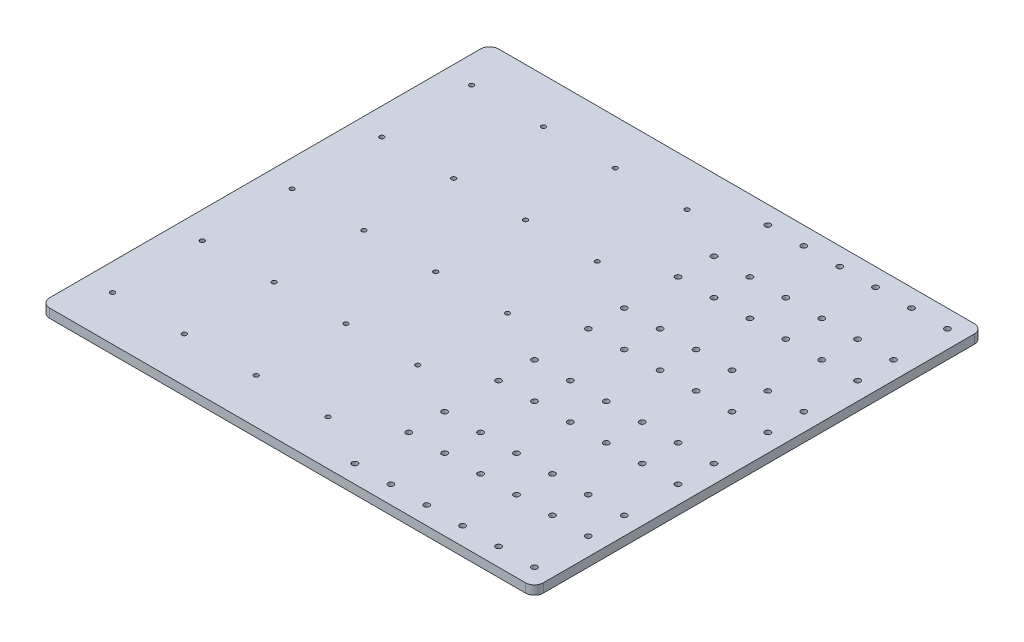
from build123d import *

# Parameters (mm, degrees)
SKETCH2_W                  = 275
SKETCH2_H                  = 50
BOSS_EXTRUDE1_DEPTH        = 5
SKETCH3_R                  = 1.25
CUT_EXTRUDE1_DEPTH         = 140.843662709
SKETCH5_R                  = 1.55
CUT_EXTRUDE3_DEPTH         = 140.843662709
LPATTERN1_COUNT            = 6
LPATTERN1_PITCH            = 20
LPATTERN3_COUNT            = 5
LPATTERN3_PITCH            = 50
LPATTERN3_COPY_1_SKETCH_R  = 1.55
LPATTERN3_COPY_1_DEPTH     = 140.843662709
LPATTERN3_COPY_2_SKETCH_R  = 1.55
LPATTERN3_COPY_2_DEPTH     = 140.843662709
LPATTERN3_COPY_3_SKETCH_R  = 1.55
LPATTERN3_COPY_3_DEPTH     = 140.843662709
LPATTERN3_COPY_4_SKETCH_R  = 1.55
LPATTERN3_COPY_4_DEPTH     = 140.843662709
LPATTERN3_COPY_5_SKETCH_R  = 1.55
LPATTERN3_COPY_5_DEPTH     = 140.843662709
LPATTERN3_COPY_6_SKETCH_R  = 1.55
LPATTERN3_COPY_6_DEPTH     = 140.843662709
LPATTERN3_COPY_7_SKETCH_R  = 1.55
LPATTERN3_COPY_7_DEPTH     = 140.843662709
LPATTERN3_COPY_8_SKETCH_R  = 1.55
LPATTERN3_COPY_8_DEPTH     = 140.843662709
LPATTERN3_COPY_9_SKETCH_R  = 1.55
LPATTERN3_COPY_9_DEPTH     = 140.843662709
LPATTERN3_COPY_10_SKETCH_R = 1.55
LPATTERN3_COPY_10_DEPTH    = 140.843662709
LPATTERN3_COPY_11_SKETCH_R = 1.55
LPATTERN3_COPY_11_DEPTH    = 140.843662709
LPATTERN3_COPY_12_SKETCH_R = 1.55
LPATTERN3_COPY_12_DEPTH    = 140.843662709
LPATTERN3_COPY_13_SKETCH_R = 1.55
LPATTERN3_COPY_13_DEPTH    = 140.843662709
LPATTERN3_COPY_14_SKETCH_R = 1.55
LPATTERN3_COPY_14_DEPTH    = 140.843662709
LPATTERN3_COPY_15_SKETCH_R = 1.55
LPATTERN3_COPY_15_DEPTH    = 140.843662709
LPATTERN3_COPY_16_SKETCH_R = 1.55
LPATTERN3_COPY_16_DEPTH    = 140.843662709
LPATTERN3_COPY_17_SKETCH_R = 1.55
LPATTERN3_COPY_17_DEPTH    = 140.843662709
LPATTERN3_COPY_18_SKETCH_R = 1.55
LPATTERN3_COPY_18_DEPTH    = 140.843662709
LPATTERN3_COPY_19_SKETCH_R = 1.55
LPATTERN3_COPY_19_DEPTH    = 140.843662709
LPATTERN3_COPY_20_SKETCH_R = 1.55
LPATTERN3_COPY_20_DEPTH    = 140.843662709
FILLET1_R                  = 5


with BuildPart() as part:
    # Sketch2 → Boss-Extrude1 (new body)
    with BuildSketch(Plane(origin=(0, 0, 0), x_dir=(1, 0, 0), z_dir=(0, 1, 0))):
        Rectangle(SKETCH2_W, SKETCH2_H)
    boss_extrude1 = extrude(amount=BOSS_EXTRUDE1_DEPTH)

    # Sketch3 → Cut-Extrude1 (cut, through all)
    with BuildSketch(Plane.XZ):
        with Locations(Location((-122.5, 0, 0), (0, 0, 270))):
            Circle(SKETCH3_R)
        with Locations(Location((-82.5, 0, 0), (0, 0, 270))):
            Circle(SKETCH3_R)
        with Locations(Location((-42.5, 0, 0), (0, 0, 270))):
            Circle(SKETCH3_R)
        with Locations(Location((-2.5, 0, 0), (0, 0, 270))):
            Circle(SKETCH3_R)
    cut_extrude1 = extrude(amount=-CUT_EXTRUDE1_DEPTH, mode=Mode.SUBTRACT)

    # Sketch5 → Cut-Extrude3 (cut, through all)
    with BuildSketch(Plane.XZ):
        with Locations(Location((127.5, 15, 0), (0, 0, 270))):
            Circle(SKETCH5_R)
        with Locations(Location((127.5, -15, 0), (0, 0, 270))):
            Circle(SKETCH5_R)
    cut_extrude3 = extrude(amount=-CUT_EXTRUDE3_DEPTH, mode=Mode.SUBTRACT)

    # LPattern1: Cut-Extrude3 ×6
    with Locations(*[(-i * LPATTERN1_PITCH, 0, 0) for i in range(1, LPATTERN1_COUNT)]):
        add(cut_extrude3, mode=Mode.SUBTRACT)

    # LPattern3: Boss-Extrude1, Cut-Extrude1, Cut-Extrude3 ×5
    with Locations(*[(0, 0, -i * LPATTERN3_PITCH) for i in range(1, LPATTERN3_COUNT)]):
        add(boss_extrude1)
        add(cut_extrude1, mode=Mode.SUBTRACT)
        add(cut_extrude3, mode=Mode.SUBTRACT)

    # LPattern3 copy 1 sketch → LPattern3 copy 1 (cut, through all)
    with BuildSketch(Plane(origin=(-20, 0, -50), x_dir=(1, 0, 0), z_dir=(0, -1, 0))):
        with Locations(Location((127.5, 15, 0), (0, 0, 270))):
            Circle(LPATTERN3_COPY_1_SKETCH_R)
        with Locations(Location((127.5, -15, 0), (0, 0, 270))):
            Circle(LPATTERN3_COPY_1_SKETCH_R)
    extrude(amount=-LPATTERN3_COPY_1_DEPTH, mode=Mode.SUBTRACT)

    # LPattern3 copy 2 sketch → LPattern3 copy 2 (cut, through all)
    with BuildSketch(Plane(origin=(-20, 0, -100), x_dir=(1, 0, 0), z_dir=(0, -1, 0))):
        with Locations(Location((127.5, 15, 0), (0, 0, 270))):
            Circle(LPATTERN3_COPY_2_SKETCH_R)
        with Locations(Location((127.5, -15, 0), (0, 0, 270))):
            Circle(LPATTERN3_COPY_2_SKETCH_R)
    extrude(amount=-LPATTERN3_COPY_2_DEPTH, mode=Mode.SUBTRACT)

    # LPattern3 copy 3 sketch → LPattern3 copy 3 (cut, through all)
    with BuildSketch(Plane(origin=(-20, 0, -150), x_dir=(1, 0, 0), z_dir=(0, -1, 0))):
        with Locations(Location((127.5, 15, 0), (0, 0, 270))):
            Circle(LPATTERN3_COPY_3_SKETCH_R)
        with Locations(Location((127.5, -15, 0), (0, 0, 270))):
            Circle(LPATTERN3_COPY_3_SKETCH_R)
    extrude(amount=-LPATTERN3_COPY_3_DEPTH, mode=Mode.SUBTRACT)

    # LPattern3 copy 4 sketch → LPattern3 copy 4 (cut, through all)
    with BuildSketch(Plane(origin=(-20, 0, -200), x_dir=(1, 0, 0), z_dir=(0, -1, 0))):
        with Locations(Location((127.5, 15, 0), (0, 0, 270))):
            Circle(LPATTERN3_COPY_4_SKETCH_R)
        with Locations(Location((127.5, -15, 0), (0, 0, 270))):
            Circle(LPATTERN3_COPY_4_SKETCH_R)
    extrude(amount=-LPATTERN3_COPY_4_DEPTH, mode=Mode.SUBTRACT)

    # LPattern3 copy 5 sketch → LPattern3 copy 5 (cut, through all)
    with BuildSketch(Plane(origin=(-40, 0, -50), x_dir=(1, 0, 0), z_dir=(0, -1, 0))):
        with Locations(Location((127.5, 15, 0), (0, 0, 270))):
            Circle(LPATTERN3_COPY_5_SKETCH_R)
        with Locations(Location((127.5, -15, 0), (0, 0, 270))):
            Circle(LPATTERN3_COPY_5_SKETCH_R)
    extrude(amount=-LPATTERN3_COPY_5_DEPTH, mode=Mode.SUBTRACT)

    # LPattern3 copy 6 sketch → LPattern3 copy 6 (cut, through all)
    with BuildSketch(Plane(origin=(-40, 0, -100), x_dir=(1, 0, 0), z_dir=(0, -1, 0))):
        with Locations(Location((127.5, 15, 0), (0, 0, 270))):
            Circle(LPATTERN3_COPY_6_SKETCH_R)
        with Locations(Location((127.5, -15, 0), (0, 0, 270))):
            Circle(LPATTERN3_COPY_6_SKETCH_R)
    extrude(amount=-LPATTERN3_COPY_6_DEPTH, mode=Mode.SUBTRACT)

    # LPattern3 copy 7 sketch → LPattern3 copy 7 (cut, through all)
    with BuildSketch(Plane(origin=(-40, 0, -150), x_dir=(1, 0, 0), z_dir=(0, -1, 0))):
        with Locations(Location((127.5, 15, 0), (0, 0, 270))):
            Circle(LPATTERN3_COPY_7_SKETCH_R)
        with Locations(Location((127.5, -15, 0), (0, 0, 270))):
            Circle(LPATTERN3_COPY_7_SKETCH_R)
    extrude(amount=-LPATTERN3_COPY_7_DEPTH, mode=Mode.SUBTRACT)

    # LPattern3 copy 8 sketch → LPattern3 copy 8 (cut, through all)
    with BuildSketch(Plane(origin=(-40, 0, -200), x_dir=(1, 0, 0), z_dir=(0, -1, 0))):
        with Locations(Location((127.5, 15, 0), (0, 0, 270))):
            Circle(LPATTERN3_COPY_8_SKETCH_R)
        with Locations(Location((127.5, -15, 0), (0, 0, 270))):
            Circle(LPATTERN3_COPY_8_SKETCH_R)
    extrude(amount=-LPATTERN3_COPY_8_DEPTH, mode=Mode.SUBTRACT)

    # LPattern3 copy 9 sketch → LPattern3 copy 9 (cut, through all)
    with BuildSketch(Plane(origin=(-60, 0, -50), x_dir=(1, 0, 0), z_dir=(0, -1, 0))):
        with Locations(Location((127.5, 15, 0), (0, 0, 270))):
            Circle(LPATTERN3_COPY_9_SKETCH_R)
        with Locations(Location((127.5, -15, 0), (0, 0, 270))):
            Circle(LPATTERN3_COPY_9_SKETCH_R)
    extrude(amount=-LPATTERN3_COPY_9_DEPTH, mode=Mode.SUBTRACT)

    # LPattern3 copy 10 sketch → LPattern3 copy 10 (cut, through all)
    with BuildSketch(Plane(origin=(-60, 0, -100), x_dir=(1, 0, 0), z_dir=(0, -1, 0))):
        with Locations(Location((127.5, 15, 0), (0, 0, 270))):
            Circle(LPATTERN3_COPY_10_SKETCH_R)
        with Locations(Location((127.5, -15, 0), (0, 0, 270))):
            Circle(LPATTERN3_COPY_10_SKETCH_R)
    extrude(amount=-LPATTERN3_COPY_10_DEPTH, mode=Mode.SUBTRACT)

    # LPattern3 copy 11 sketch → LPattern3 copy 11 (cut, through all)
    with BuildSketch(Plane(origin=(-60, 0, -150), x_dir=(1, 0, 0), z_dir=(0, -1, 0))):
        with Locations(Location((127.5, 15, 0), (0, 0, 270))):
            Circle(LPATTERN3_COPY_11_SKETCH_R)
        with Locations(Location((127.5, -15, 0), (0, 0, 270))):
            Circle(LPATTERN3_COPY_11_SKETCH_R)
    extrude(amount=-LPATTERN3_COPY_11_DEPTH, mode=Mode.SUBTRACT)

    # LPattern3 copy 12 sketch → LPattern3 copy 12 (cut, through all)
    with BuildSketch(Plane(origin=(-60, 0, -200), x_dir=(1, 0, 0), z_dir=(0, -1, 0))):
        with Locations(Location((127.5, 15, 0), (0, 0, 270))):
            Circle(LPATTERN3_COPY_12_SKETCH_R)
        with Locations(Location((127.5, -15, 0), (0, 0, 270))):
            Circle(LPATTERN3_COPY_12_SKETCH_R)
    extrude(amount=-LPATTERN3_COPY_12_DEPTH, mode=Mode.SUBTRACT)

    # LPattern3 copy 13 sketch → LPattern3 copy 13 (cut, through all)
    with BuildSketch(Plane(origin=(-80, 0, -50), x_dir=(1, 0, 0), z_dir=(0, -1, 0))):
        with Locations(Location((127.5, 15, 0), (0, 0, 270))):
            Circle(LPATTERN3_COPY_13_SKETCH_R)
        with Locations(Location((127.5, -15, 0), (0, 0, 270))):
            Circle(LPATTERN3_COPY_13_SKETCH_R)
    extrude(amount=-LPATTERN3_COPY_13_DEPTH, mode=Mode.SUBTRACT)

    # LPattern3 copy 14 sketch → LPattern3 copy 14 (cut, through all)
    with BuildSketch(Plane(origin=(-80, 0, -100), x_dir=(1, 0, 0), z_dir=(0, -1, 0))):
        with Locations(Location((127.5, 15, 0), (0, 0, 270))):
            Circle(LPATTERN3_COPY_14_SKETCH_R)
        with Locations(Location((127.5, -15, 0), (0, 0, 270))):
            Circle(LPATTERN3_COPY_14_SKETCH_R)
    extrude(amount=-LPATTERN3_COPY_14_DEPTH, mode=Mode.SUBTRACT)

    # LPattern3 copy 15 sketch → LPattern3 copy 15 (cut, through all)
    with BuildSketch(Plane(origin=(-80, 0, -150), x_dir=(1, 0, 0), z_dir=(0, -1, 0))):
        with Locations(Location((127.5, 15, 0), (0, 0, 270))):
            Circle(LPATTERN3_COPY_15_SKETCH_R)
        with Locations(Location((127.5, -15, 0), (0, 0, 270))):
            Circle(LPATTERN3_COPY_15_SKETCH_R)
    extrude(amount=-LPATTERN3_COPY_15_DEPTH, mode=Mode.SUBTRACT)

    # LPattern3 copy 16 sketch → LPattern3 copy 16 (cut, through all)
    with BuildSketch(Plane(origin=(-80, 0, -200), x_dir=(1, 0, 0), z_dir=(0, -1, 0))):
        with Locations(Location((127.5, 15, 0), (0, 0, 270))):
            Circle(LPATTERN3_COPY_16_SKETCH_R)
        with Locations(Location((127.5, -15, 0), (0, 0, 270))):
            Circle(LPATTERN3_COPY_16_SKETCH_R)
    extrude(amount=-LPATTERN3_COPY_16_DEPTH, mode=Mode.SUBTRACT)

    # LPattern3 copy 17 sketch → LPattern3 copy 17 (cut, through all)
    with BuildSketch(Plane(origin=(-100, 0, -50), x_dir=(1, 0, 0), z_dir=(0, -1, 0))):
        with Locations(Location((127.5, 15, 0), (0, 0, 270))):
            Circle(LPATTERN3_COPY_17_SKETCH_R)
        with Locations(Location((127.5, -15, 0), (0, 0, 270))):
            Circle(LPATTERN3_COPY_17_SKETCH_R)
    extrude(amount=-LPATTERN3_COPY_17_DEPTH, mode=Mode.SUBTRACT)

    # LPattern3 copy 18 sketch → LPattern3 copy 18 (cut, through all)
    with BuildSketch(Plane(origin=(-100, 0, -100), x_dir=(1, 0, 0), z_dir=(0, -1, 0))):
        with Locations(Location((127.5, 15, 0), (0, 0, 270))):
            Circle(LPATTERN3_COPY_18_SKETCH_R)
        with Locations(Location((127.5, -15, 0), (0, 0, 270))):
            Circle(LPATTERN3_COPY_18_SKETCH_R)
    extrude(amount=-LPATTERN3_COPY_18_DEPTH, mode=Mode.SUBTRACT)

    # LPattern3 copy 19 sketch → LPattern3 copy 19 (cut, through all)
    with BuildSketch(Plane(origin=(-100, 0, -150), x_dir=(1, 0, 0), z_dir=(0, -1, 0))):
        with Locations(Location((127.5, 15, 0), (0, 0, 270))):
            Circle(LPATTERN3_COPY_19_SKETCH_R)
        with Locations(Location((127.5, -15, 0), (0, 0, 270))):
            Circle(LPATTERN3_COPY_19_SKETCH_R)
    extrude(amount=-LPATTERN3_COPY_19_DEPTH, mode=Mode.SUBTRACT)

    # LPattern3 copy 20 sketch → LPattern3 copy 20 (cut, through all)
    with BuildSketch(Plane(origin=(-100, 0, -200), x_dir=(1, 0, 0), z_dir=(0, -1, 0))):
        with Locations(Location((127.5, 15, 0), (0, 0, 270))):
            Circle(LPATTERN3_COPY_20_SKETCH_R)
        with Locations(Location((127.5, -15, 0), (0, 0, 270))):
            Circle(LPATTERN3_COPY_20_SKETCH_R)
    extrude(amount=-LPATTERN3_COPY_20_DEPTH, mode=Mode.SUBTRACT)

    # Fillet1
    fillet1_edges = [part.edges().sort_by_distance(p)[0] for p in [
        (-137.5, 2.5, -225),
        (137.5, 2.5, -225),
        (137.5, 2.5, 25),
        (-137.5, 2.5, 25),
    ]]
    fillet(fillet1_edges, radius=FILLET1_R)


solid = part.part
